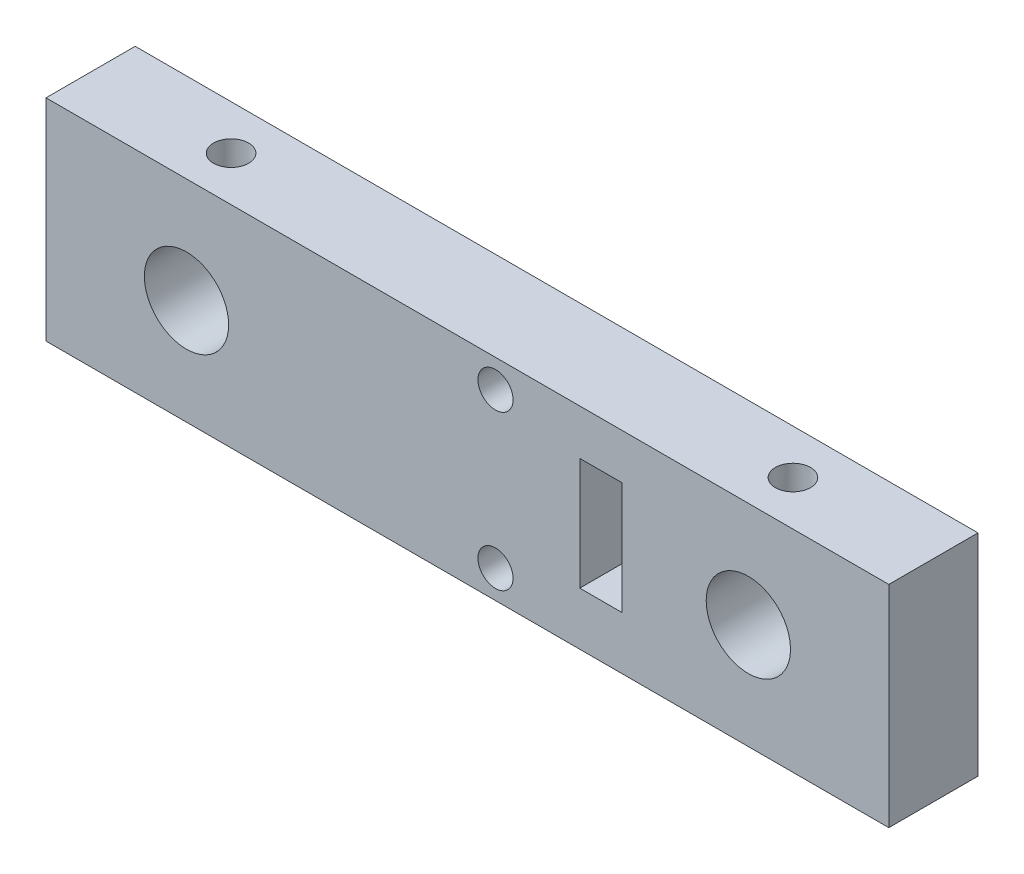
from build123d import *

# Parameters (mm, degrees)
SKETCH1_W             = 60
SKETCH1_H             = 15
SKETCH1_R             = 3
BOSS_EXTRUDE1_DEPTH   = 6.35
M3_TAPPED_HOLE1_D     = 2.5
M3_TAPPED_HOLE1_DEPTH = 8.5
M3_TAPPED_HOLE1_TIP   = 0.751075774
SKETCH5_W             = 3
SKETCH5_H             = 8
CUT_EXTRUDE1_DEPTH    = 63.171717881
M3_TAPPED_HOLE2_D     = 2.5


with BuildPart() as part:
    # Sketch1 → Boss-Extrude1 (new body)
    with BuildSketch(Plane.XY):
        with Locations((30, 7.5)):
            Rectangle(SKETCH1_W, SKETCH1_H)
        with Locations((10, 7.5)):
            Circle(SKETCH1_R, mode=Mode.SUBTRACT)
        with Locations((50, 7.5)):
            Circle(SKETCH1_R, mode=Mode.SUBTRACT)
    extrude(amount=BOSS_EXTRUDE1_DEPTH)

    # M3 Tapped Hole1
    with Locations(Plane(origin=(0, 15, 0), x_dir=(-1, 0, 0), z_dir=(0, 1, 0))):
        with Locations((-10, 3.175), (-50, 3.175)):
            Hole(M3_TAPPED_HOLE1_D / 2, depth=M3_TAPPED_HOLE1_DEPTH)
            with Locations((0, 0, -(M3_TAPPED_HOLE1_DEPTH + M3_TAPPED_HOLE1_TIP / 2))):  # 118° drill point
                Cone(0, M3_TAPPED_HOLE1_D / 2, M3_TAPPED_HOLE1_TIP, mode=Mode.SUBTRACT)

    # Sketch5 → Cut-Extrude1 (cut, through all)
    with BuildSketch(Plane.XY.offset(6.35)):
        with Locations((39.5, 7.769310746)):
            Rectangle(SKETCH5_W, SKETCH5_H)
    extrude(amount=-CUT_EXTRUDE1_DEPTH, mode=Mode.SUBTRACT)

    # M3 Tapped Hole2 (through all)
    with Locations(Plane.XY.offset(6.35)):
        with Locations((32, 13), (32, 2)):
            Hole(M3_TAPPED_HOLE2_D / 2)


solid = part.part
